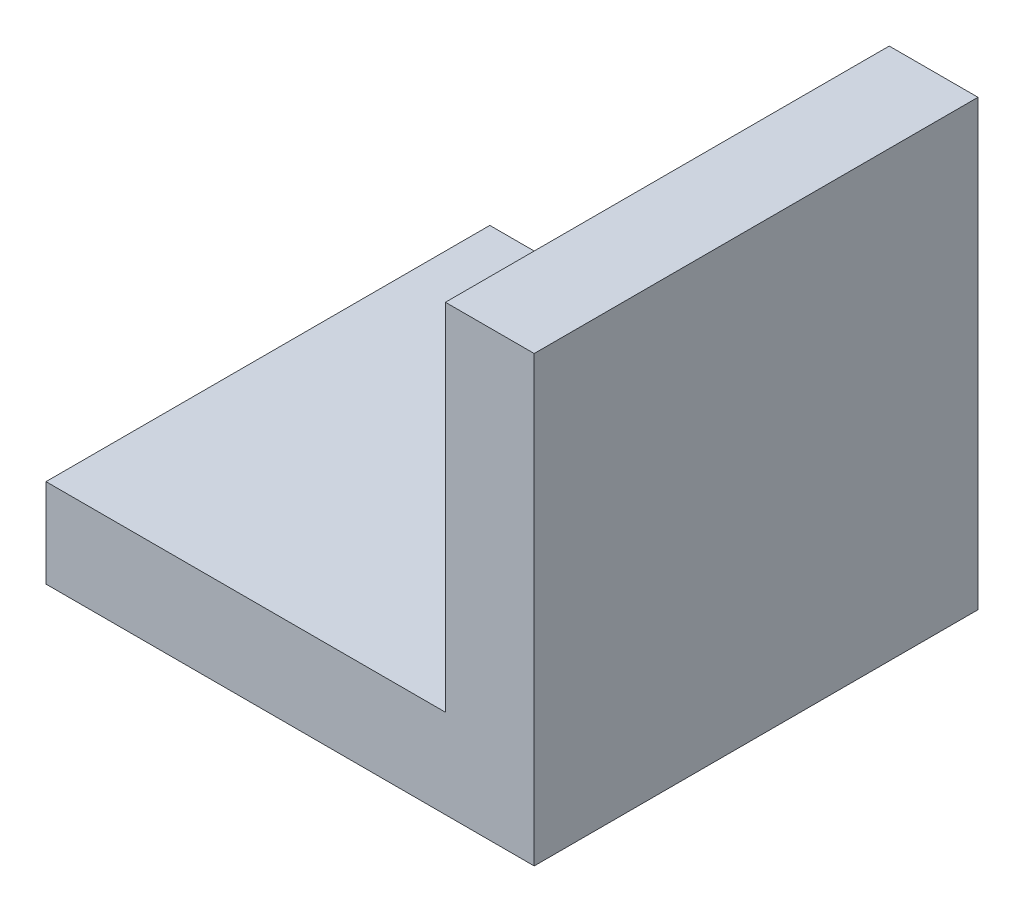
from build123d import *

# Parameters (mm, degrees)
BOSS_EXTRU_1_DEPTH = 50


with BuildPart() as part:
    # Esquisse1 → Boss.-Extru.1 (new body)
    with BuildSketch(Plane.XY):
        Polygon((0, 0), (-55, 0), (-55, 10), (-10, 10), (-10, 50), (0, 50), align=None)
    extrude(amount=BOSS_EXTRU_1_DEPTH)


solid = part.part
